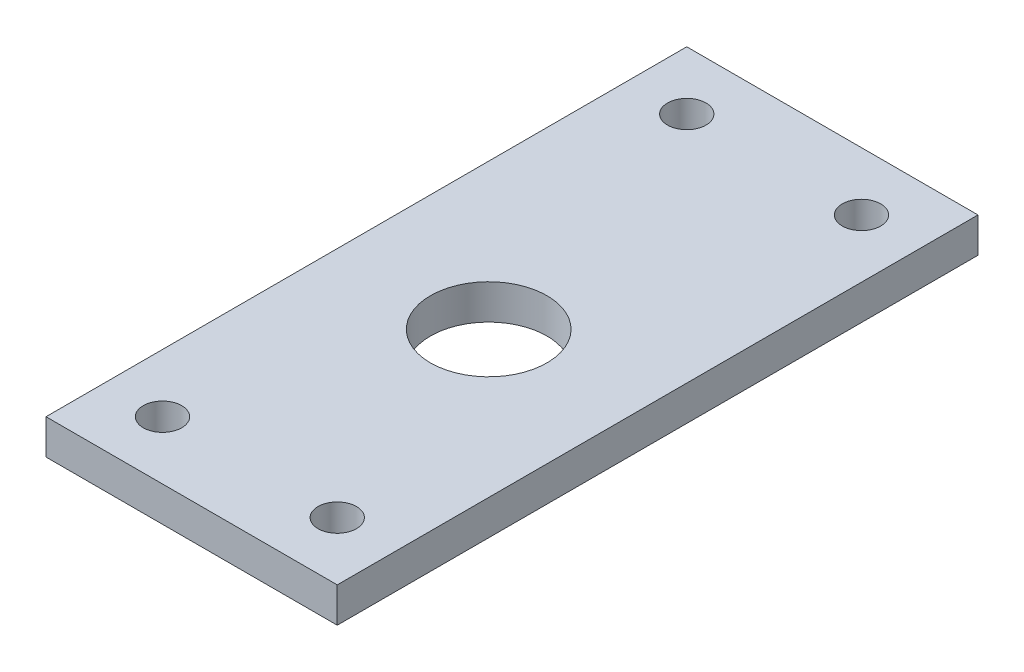
from build123d import *

# Parameters (mm, degrees)
SKETCH_1_W      = 25
SKETCH_1_H      = 55
EXTRUDE_1_DEPTH = 3
HOLE_WIZARD_1_D = 3.3
HOLE_WIZARD_2_D = 10


with BuildPart() as part:
    # 草图1 → 凸台-拉伸1 (new body)
    with BuildSketch(Plane(origin=(0, 0, 0), x_dir=(1, 0, 0), z_dir=(0, 1, 0))):
        Rectangle(SKETCH_1_W, SKETCH_1_H)
    extrude(amount=EXTRUDE_1_DEPTH)

    # 孔1 (through all)
    with Locations(Plane(origin=(0, 3, 0), x_dir=(1, 0, 0), z_dir=(0, 1, 0))):
        with Locations((-7.5, 22.5), (7.5, 22.5), (7.5, -22.5), (-7.5, -22.5)):
            Hole(HOLE_WIZARD_1_D / 2)

    # 孔2 (through all)
    with Locations(Plane(origin=(0, 3, 0), x_dir=(1, 0, 0), z_dir=(0, 1, 0))):
        with Locations((0, -2)):
            Hole(HOLE_WIZARD_2_D / 2)


solid = part.part
